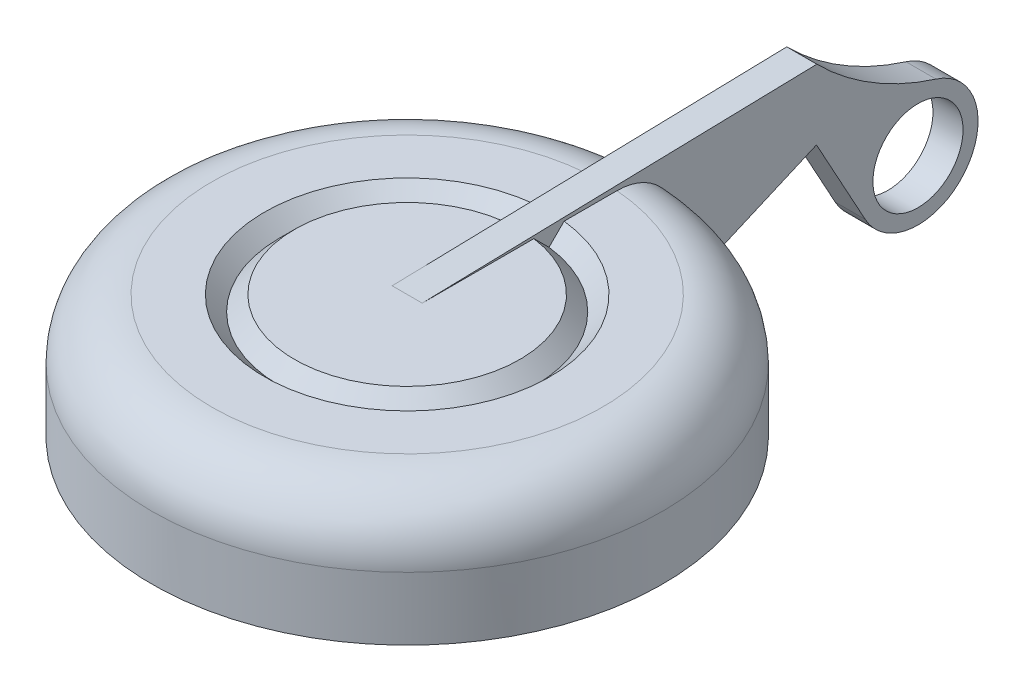
from build123d import *

# Parameters (mm, degrees)
FILLET1_R                = 2
SKETCH5_R                = 8.5
SKETCH5_R_2              = 7
BOSS_EXTRUDE1_DEPTH      = 0.1
BOSS_EXTRUDE2_DEPTH      = 0.5
BOSS_EXTRUDE2_DEPTH_BACK = 0.5
SKETCH6_R                = 1.5


with BuildPart() as part:
    # Sketch4 → Revolve1 (revolve)
    with BuildSketch(Plane(origin=(0, 0, 0), x_dir=(0, 0, -1), z_dir=(1, 0, 0))):
        Polygon((0, 0), (-3.75, 0), (-4.25, -0.5), (-4.75, 0), (-8.5, 0), (-8.5, -4), (0, -4), align=None)
    revolve(axis=Axis((0, 1.890471386, 0), (0, -1, 0)))

    # Fillet1
    fillet1_edges = [part.edges().sort_by_distance(p)[0] for p in [
        (0, 0, -8.5),
    ]]
    fillet(fillet1_edges, radius=FILLET1_R)



with BuildPart() as body_2:
    # Sketch5 → Boss-Extrude1 (new body)
    with BuildSketch(Plane.XZ.offset(4)):
        Circle(SKETCH5_R)
        Circle(SKETCH5_R_2, mode=Mode.SUBTRACT)
    extrude(amount=BOSS_EXTRUDE1_DEPTH)


with BuildPart() as part_1:
    add(part.part)

    add(body_2.part)  # Boss-Extrude2 merges body 2
    # Sketch6 → Boss-Extrude2 (add, two sides: drawn at the far end of the back side and taken through both)
    with BuildSketch(Plane(origin=(0, 0, 0), x_dir=(0, 0, -1), z_dir=(1, 0, 0)).offset(-BOSS_EXTRUDE2_DEPTH_BACK)):
        with BuildLine():
            Line((13.132863069, 0.320027848), (0, 0))
            Line((0, 0), (0, -0.907670556))
            Line((0, -0.907670556), (7.174444166, -0.907670556))
            Line((7.174444166, -0.907670556), (8.5, -4))
            Line((8.5, -4), (13.12184584, -1.999779955))
            Line((13.12184584, -1.999779955), (14.746442499, -4.961787965))
            ThreePointArc((14.746442499, -4.961787965), (18.046890478, -5.267726252), (17.098589091, -2.09167846))
            ThreePointArc((17.098589091, -2.09167846), (14.968839585, -1.127360353), (13.132863069, 0.320027848))
        make_face()
        with Locations((16.5, -4)):
            Circle(SKETCH6_R, mode=Mode.SUBTRACT)
    extrude(amount=BOSS_EXTRUDE2_DEPTH + BOSS_EXTRUDE2_DEPTH_BACK)


solid = part_1.part
